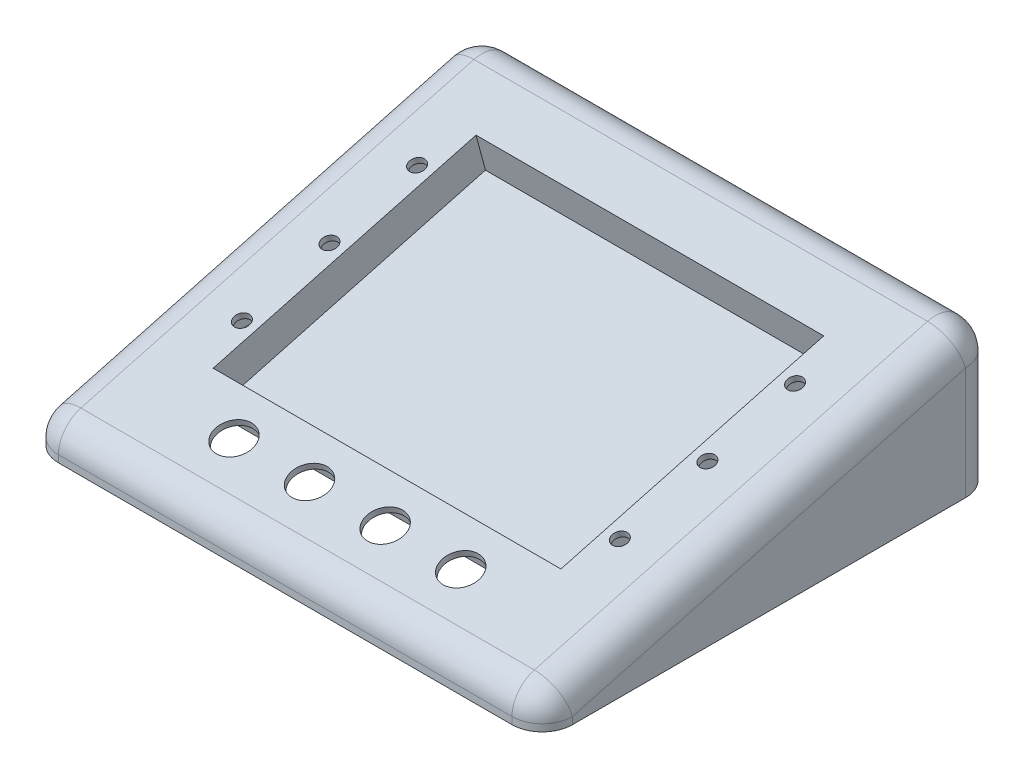
from build123d import *

# Parameters (mm, degrees)
SKETCH1_W           = 170
SKETCH1_H           = 150
BOSS_EXTRUDE1_DEPTH = 10
BOSS_EXTRUDE2_DEPTH = 170
FILLET1_R           = 10
SHELL1_T            = -2
SKETCH3_W           = 115
SKETCH3_H           = 90
CUT_EXTRUDE1_DEPTH  = 2
SKETCH4_W           = 119
SKETCH4_H           = 94
SKETCH4_W_2         = 115
SKETCH4_H_2         = 90
BOSS_EXTRUDE3_DEPTH = 10
SKETCH5_W           = 119
SKETCH5_H           = 94
BOSS_EXTRUDE4_DEPTH = 2
SKETCH6_R           = 2.5
CUT_EXTRUDE2_DEPTH  = 2
SKETCH7_R           = 6
CUT_EXTRUDE3_DEPTH  = 2


with BuildPart() as part:
    # Sketch1 → Boss-Extrude1 (new body)
    with BuildSketch(Plane(origin=(0, 0, 0), x_dir=(1, 0, 0), z_dir=(0, 1, 0))):
        Rectangle(SKETCH1_W, SKETCH1_H)
    extrude(amount=BOSS_EXTRUDE1_DEPTH)

    # Sketch2 → Boss-Extrude2 (add)
    with BuildSketch(Plane.ZY.offset(85)):
        Polygon((-75, 10), (-75, 50.192378865), (75, 10), align=None)
    extrude(amount=-BOSS_EXTRUDE2_DEPTH)

    # Fillet1
    fillet1_edges = [part.edges().sort_by_distance(p)[0] for p in [
        (0, 50.192378865, -75),
        (-85, 30.096189432, 0),
        (85, 30.096189432, 0),
        (0, 10, 75),
        (85, 5, 75),
        (-85, 5, 75),
        (-85, 25.096189432, -75),
        (85, 25.096189432, -75),
    ]]
    fillet(fillet1_edges, radius=FILLET1_R)

    # Shell1
    shell1_openings = [part.faces().sort_by_distance(p)[0] for p in [
        (0, 0, 0),
    ]]
    offset(amount=SHELL1_T, openings=shell1_openings, kind=Kind.INTERSECTION)

    # Sketch3 → Cut-Extrude1 (cut)
    with BuildSketch(Plane(origin=(0, 28.080127019, 7.524047358), x_dir=(1, 0, 0), z_dir=(0, 0.96592582628907, 0.25881904510251436))):
        with Locations((0, 10)):
            Rectangle(SKETCH3_W, SKETCH3_H)
    extrude(amount=-CUT_EXTRUDE1_DEPTH, mode=Mode.SUBTRACT)

    # Sketch4 → Boss-Extrude3 (add)
    with BuildSketch(Plane(origin=(0, 26.148275366, 7.006409268), x_dir=(1, 0, 0), z_dir=(0, -0.96592582628907, -0.25881904510251436))):
        with Locations((0, -10)):
            Rectangle(SKETCH4_W, SKETCH4_H)
        with Locations((0, -10)):
            Rectangle(SKETCH4_W_2, SKETCH4_H_2, mode=Mode.SUBTRACT)
    extrude(amount=BOSS_EXTRUDE3_DEPTH)

    # Sketch5 → Boss-Extrude4 (add)
    with BuildSketch(Plane(origin=(0, 16.489017103, 4.418218817), x_dir=(1, 0, 0), z_dir=(0, -0.96592582628907, -0.25881904510251436))):
        with Locations((0, -10)):
            Rectangle(SKETCH5_W, SKETCH5_H)
    extrude(amount=BOSS_EXTRUDE4_DEPTH)

    # Sketch6 → Cut-Extrude2 (cut)
    with BuildSketch(Plane(origin=(0, 28.080127019, 7.524047358), x_dir=(1, 0, 0), z_dir=(0, 0.96592582628907, 0.25881904510251436))):
        with Locations(Location((-62.5, 10, 0), (0, 0, 270))):
            Circle(SKETCH6_R)
        with Locations(Location((-62.5, 40, 0), (0, 0, 270))):
            Circle(SKETCH6_R)
        with Locations(Location((-62.5, -20, 0), (0, 0, 270))):
            Circle(SKETCH6_R)
        with Locations(Location((62.5, -20, 0), (0, 0, 270))):
            Circle(SKETCH6_R)
        with Locations(Location((62.5, 40, 0), (0, 0, 270))):
            Circle(SKETCH6_R)
        with Locations(Location((62.5, 10, 0), (0, 0, 270))):
            Circle(SKETCH6_R)
    extrude(amount=-CUT_EXTRUDE2_DEPTH, mode=Mode.SUBTRACT)

    # Sketch7 → Cut-Extrude3 (cut)
    with BuildSketch(Plane(origin=(0, 28.080127019, 7.524047358), x_dir=(1, 0, 0), z_dir=(0, 0.96592582628907, 0.25881904510251436))):
        with Locations(Location((-12.5, -48.59148832, 0), (0, 0, 270))):
            Circle(SKETCH7_R)
        with Locations(Location((12.5, -48.59148832, 0), (0, 0, 270))):
            Circle(SKETCH7_R)
        with Locations(Location((37.5, -48.59148832, 0), (0, 0, 270))):
            Circle(SKETCH7_R)
        with Locations(Location((-37.5, -48.59148832, 0), (0, 0, 270))):
            Circle(SKETCH7_R)
    extrude(amount=-CUT_EXTRUDE3_DEPTH, mode=Mode.SUBTRACT)


solid = part.part
